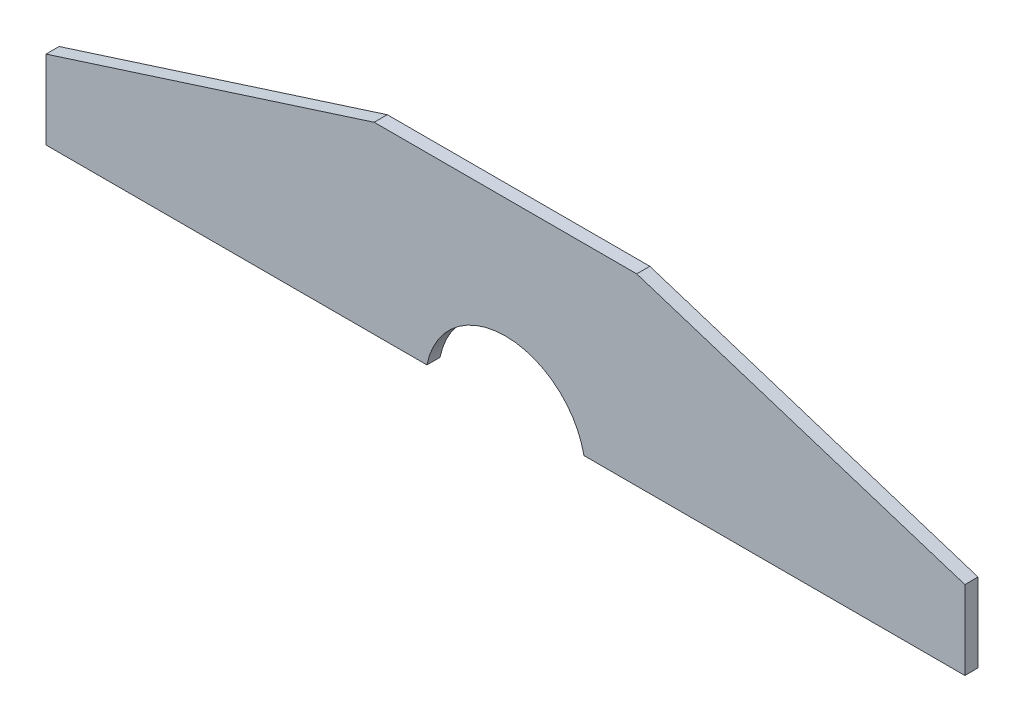
from build123d import *

# Parameters (mm, degrees)
BOSS_EXTRUDE1_DEPTH = 5


with BuildPart() as part:
    # Sketch1 → Boss-Extrude1 (new body)
    with BuildSketch(Plane.XY):
        with BuildLine():
            Line((-175, 36), (-50, 76))
            Line((-50, 76), (50, 76))
            Line((50, 76), (175, 36))
            Line((175, 36), (175, 6))
            Line((175, 6), (29.904013109, 6))
            ThreePointArc((29.904013109, 6), (0, 30.5), (-29.904013109, 6))
            Line((-29.904013109, 6), (-175, 6))
            Line((-175, 6), (-175, 36))
        make_face()
    extrude(amount=BOSS_EXTRUDE1_DEPTH)


solid = part.part
